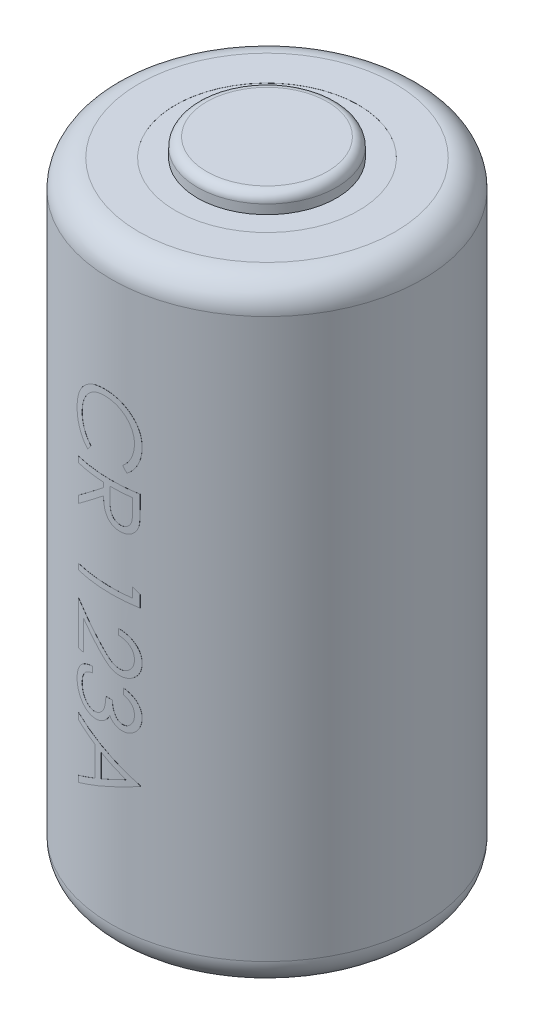
from build123d import *

# Parameters (mm, degrees)
SKIZZE1_R                            = 8.5
AUFSATZ_LINEAR_AUSTRAGEN1_DEPTH      = 33.5
SKIZZE2_R                            = 3.799988553
AUFSATZ_LINEAR_AUSTRAGEN2_DEPTH      = 1
VERRUNDUNG1_R                        = 1.5
VERRUNDUNG2_R                        = 0.5
SCHNITT_LINEAR_START                 = -0.005
SKIZZE3_R                            = 5
SKIZZE3_R_2                          = 3.799988553
SCHNITT_LINEAR_AUSTRAGEN1_DEPTH      = 0.005
AUFSATZ_LINEAR_AUSTRAGEN3_REACH      = 38.534
AUFSATZ_LINEAR_AUSTRAGEN3_END_RADIUS = 8.505


with BuildPart() as part:
    # Skizze1 → Aufsatz-Linear austragen1 (new body)
    with BuildSketch(Plane(origin=(0, 0, 0), x_dir=(1, 0, 0), z_dir=(0, 1, 0))):
        with Locations(Location((0, 0, 0), (0, 0, 270))):
            Circle(SKIZZE1_R)
    extrude(amount=AUFSATZ_LINEAR_AUSTRAGEN1_DEPTH)

    # Skizze2 → Aufsatz-Linear austragen2 (add)
    with BuildSketch(Plane(origin=(0, 33.5, 0), x_dir=(1, 0, 0), z_dir=(0, 1, 0))):
        with Locations(Location((0, 0, 0), (0, 0, 270))):
            Circle(SKIZZE2_R)
    extrude(amount=AUFSATZ_LINEAR_AUSTRAGEN2_DEPTH)

    # Verrundung1
    verrundung1_edges = [part.edges().sort_by_distance(p)[0] for p in [
        (0, 0, -8.5),
        (0, 33.5, -8.5),
    ]]
    fillet(verrundung1_edges, radius=VERRUNDUNG1_R)

    # Verrundung2
    verrundung2_edges = [part.edges().sort_by_distance(p)[0] for p in [
        (0, 34.5, -3.799988553),
    ]]
    fillet(verrundung2_edges, radius=VERRUNDUNG2_R)

    # Skizze3 → Schnitt-Linear austragen1 (cut)
    with BuildSketch(Plane(origin=(0, 33.5, 0), x_dir=(1, 0, 0), z_dir=(0, 1, 0)).offset(SCHNITT_LINEAR_START)):
        with Locations(Location((0, 0, 0), (0, 0, 270))):
            Circle(SKIZZE3_R)
        with Locations(Location((0, 0, 0), (0, 0, 270))):
            Circle(SKIZZE3_R_2, mode=Mode.SUBTRACT)
    extrude(amount=SCHNITT_LINEAR_AUSTRAGEN1_DEPTH, mode=Mode.SUBTRACT)

    # Aufsatz-Linear austragen3: up to this cylinder (the profile starts inside it)
    aufsatz_linear_austragen3_end = Plane(origin=(0, 15.6548225, 0), z_dir=(0, -1, 0)) * Cylinder(AUFSATZ_LINEAR_AUSTRAGEN3_END_RADIUS, 110.548259, mode=Mode.PRIVATE)
    # Skizze4 → Aufsatz-Linear austragen3 (add, up to the surface)
    with BuildSketch(Plane.XY, mode=Mode.PRIVATE) as aufsatz_linear_austragen3_sk1:
        with BuildLine():
            Line((0.812137548, 23.222042681), (0.60180101, 23.496882424))
            add(Edge.make_bspline(
                [(0.60180101, 23.496882424), (0.62516698, 23.516488313), (0.671583895, 23.555435759), (0.73676344, 23.618094962), (0.797828701, 23.683396605), (0.855070581, 23.751315726), (0.906487347, 23.823074845), (0.95475845, 23.896935644), (0.998026188, 23.974133689), (1.050489174, 24.080885424), (1.105235329, 24.220533272), (1.15113856, 24.396328111), (1.180359736, 24.57983921), (1.183524577, 24.705036809), (1.185134343, 24.76871736)],
                knots=[0, 0, 0, 0, 0.757959112, 1.505699292, 2.245454638, 2.979532153, 3.711538275, 4.438200793, 5.171680507, 5.909471876, 7.393775596, 8.890124382, 10.418191784, 12, 12, 12, 12], degree=3))
            add(Edge.make_bspline(
                [(1.185134343, 24.76871736), (1.184728558, 24.803800233), (1.183920753, 24.873640377), (1.173338528, 24.977295144), (1.158293792, 25.079210677), (1.136513413, 25.179007988), (1.108157335, 25.276488925), (1.074903224, 25.372395725), (1.033521858, 25.465598861), (0.987821664, 25.55722001), (0.936188844, 25.644995169), (0.87988858, 25.728063146), (0.819473451, 25.806044444), (0.755099407, 25.87915515), (0.685966407, 25.946593449), (0.612887721, 26.009440138), (0.534983754, 26.066562574), (0.453715531, 26.119364439), (0.368963602, 26.166348655), (0.281261128, 26.206921801), (0.190943428, 26.24169636), (0.097825479, 26.269467711), (0.002273724, 26.291372711), (-0.09591462, 26.30650568), (-0.196548965, 26.316992708), (-0.264758187, 26.317793081), (-0.299140497, 26.318196527)],
                knots=[0, 0, 0, 0, 1.055000685, 2.100209969, 3.131349012, 4.153242145, 5.170189196, 6.184191144, 7.204341339, 8.235672124, 9.263040994, 10.265373269, 11.252624173, 12.22887325, 13.193405896, 14.155809299, 15.126090485, 16.097288279, 17.069732292, 18.038585918, 19.002221264, 19.978698174, 20.959418239, 21.948869816, 22.966084182, 24, 24, 24, 24], degree=3))
            add(Edge.make_bspline(
                [(-0.299140497, 26.318196527), (-0.350871816, 26.316934708), (-0.452439401, 26.314457293), (-0.601210012, 26.292408959), (-0.743730686, 26.258903868), (-0.879110528, 26.208688291), (-1.009018886, 26.146769241), (-1.131257739, 26.068528629), (-1.247674304, 25.977912092), (-1.355517252, 25.873637672), (-1.454030977, 25.759231856), (-1.540781558, 25.636483945), (-1.613096441, 25.505699657), (-1.673272387, 25.368323027), (-1.719529115, 25.223296913), (-1.752093239, 25.07088211), (-1.773335419, 24.911410115), (-1.775369107, 24.802440715), (-1.776404118, 24.746982584)],
                knots=[0, 0, 0, 0, 1.029171465, 2.020641659, 2.987623507, 3.938342917, 4.889210282, 5.84687017, 6.821220943, 7.821438502, 8.827599549, 9.822697543, 10.807740252, 11.797342354, 12.80366471, 13.83203677, 14.896651826, 16, 16, 16, 16], degree=3))
            add(Edge.make_bspline(
                [(-1.776404118, 24.746982584), (-1.774715339, 24.685879895), (-1.771391416, 24.565615187), (-1.743232167, 24.38924716), (-1.697574249, 24.220411395), (-1.633676327, 24.059098808), (-1.550611039, 23.905764162), (-1.449913161, 23.760167502), (-1.330624829, 23.622185931), (-1.2395417, 23.539214649), (-1.193070785, 23.496882424)],
                knots=[0, 0, 0, 0, 1.028121516, 2.023589091, 2.998037872, 3.967518031, 4.937445131, 5.927275754, 6.942489185, 8, 8, 8, 8], degree=3))
            Line((-1.193070785, 23.496882424), (-1.401303958, 23.222042681))
            add(Edge.make_bspline(
                [(-1.401303958, 23.222042681), (-1.429842459, 23.244160761), (-1.486782762, 23.288290978), (-1.567053749, 23.35974943), (-1.642560487, 23.435025101), (-1.712678052, 23.514686863), (-1.778870221, 23.597781962), (-1.838917955, 23.685774076), (-1.894650403, 23.77714341), (-1.945006838, 23.87242193), (-1.990156908, 23.971296824), (-2.028273845, 24.073665195), (-2.061580939, 24.178659772), (-2.088801157, 24.286333431), (-2.110080876, 24.397045881), (-2.12429818, 24.510417263), (-2.134040734, 24.626686893), (-2.134928563, 24.705128347), (-2.135378477, 24.744879219)],
                knots=[0, 0, 0, 0, 0.986756325, 1.968786143, 2.935506311, 3.899499537, 4.868307269, 5.8376204, 6.809456583, 7.792545619, 8.781780509, 9.778496008, 10.776623214, 11.79151764, 12.812666265, 13.856269958, 14.913646641, 16, 16, 16, 16], degree=3))
            add(Edge.make_bspline(
                [(-2.135378477, 24.744879219), (-2.135116485, 24.782522886), (-2.134598427, 24.856958576), (-2.12620626, 24.966857328), (-2.114756523, 25.073846909), (-2.097516392, 25.177621535), (-2.077172051, 25.27874751), (-2.049900795, 25.376308094), (-2.019351628, 25.471263304), (-1.983446642, 25.563231645), (-1.942930459, 25.652291345), (-1.8971389, 25.738155156), (-1.846457035, 25.820783589), (-1.792002025, 25.90098901), (-1.732024723, 25.977586593), (-1.667358089, 26.051240119), (-1.598220078, 26.122362595), (-1.548365225, 26.16636528), (-1.52329915, 26.188488995)],
                knots=[0, 0, 0, 0, 1.114604814, 2.203992996, 3.262667896, 4.300477797, 5.318619304, 6.316056647, 7.298880507, 8.271930387, 9.238335007, 10.195173496, 11.151986948, 12.108099108, 13.064862484, 14.031167946, 15.010108607, 16, 16, 16, 16], degree=3))
            add(Edge.make_bspline(
                [(-1.52329915, 26.188488995), (-1.479757961, 26.223924638), (-1.393201251, 26.294368115), (-1.25291527, 26.384493799), (-1.106447061, 26.461641354), (-0.953027132, 26.524017275), (-0.792999745, 26.572780008), (-0.62628423, 26.606561203), (-0.453036288, 26.628512807), (-0.3351995, 26.631023096), (-0.275302356, 26.632299091)],
                knots=[0, 0, 0, 0, 0.994628077, 1.977248131, 2.950237994, 3.925870899, 4.908910175, 5.911660606, 6.938484602, 8, 8, 8, 8], degree=3))
            add(Edge.make_bspline(
                [(-0.275302356, 26.632299091), (-0.212349536, 26.630736941), (-0.088493793, 26.62766351), (0.093317753, 26.601766994), (0.267255421, 26.559602465), (0.43398848, 26.501541626), (0.592562947, 26.424943857), (0.74364855, 26.332216062), (0.887121922, 26.222452515), (1.021148744, 26.097031743), (1.143684832, 25.95945716), (1.251491889, 25.812140241), (1.34120918, 25.655357794), (1.416205403, 25.490840076), (1.47384985, 25.317354359), (1.514203041, 25.135270999), (1.539320156, 24.944932082), (1.542495364, 24.815069657), (1.544108702, 24.74908595)],
                knots=[0, 0, 0, 0, 1.032901378, 2.032168977, 3.007206631, 3.966850309, 4.924221947, 5.891988639, 6.871730993, 7.884084801, 8.900290346, 9.89161143, 10.874607481, 11.860025555, 12.854717796, 13.869097222, 14.917278314, 16, 16, 16, 16], degree=3))
            add(Edge.make_bspline(
                [(1.544108702, 24.74908595), (1.543626924, 24.708871399), (1.542673293, 24.629270746), (1.533361929, 24.511519236), (1.517867523, 24.39687271), (1.49663914, 24.285053911), (1.470620258, 24.175657363), (1.436559531, 24.06980539), (1.397006677, 23.966921591), (1.352614272, 23.86692891), (1.301863581, 23.770915237), (1.246743012, 23.678898047), (1.185980195, 23.591987357), (1.121583953, 23.508548372), (1.051145443, 23.430459568), (0.97695855, 23.355490747), (0.896821888, 23.286231616), (0.840417335, 23.24347816), (0.812137548, 23.222042681)],
                knots=[0, 0, 0, 0, 1.096705196, 2.170817488, 3.219277236, 4.250701065, 5.274195539, 6.284202015, 7.28098643, 8.279664616, 9.266225751, 10.241373748, 11.203306326, 12.157093976, 13.114198862, 14.069774147, 15.032234603, 16, 16, 16, 16], degree=3))
        make_face()
    aufsatz_linear_austragen3_tool1 = extrude(aufsatz_linear_austragen3_sk1.sketch, amount=AUFSATZ_LINEAR_AUSTRAGEN3_REACH, mode=Mode.PRIVATE) & aufsatz_linear_austragen3_end
    add(aufsatz_linear_austragen3_tool1.solids().sort_by_distance((0.746809, 23.389952, 0))[0])
    # Skizze4 → Aufsatz-Linear austragen3 (add, up to the surface)
    with BuildSketch(Plane.XY, mode=Mode.PRIVATE) as aufsatz_linear_austragen3_sk2:
        with BuildLine():
            Line((1.454365112, 22.504093963), (1.454365112, 21.80367329))
            add(Edge.make_bspline(
                [(1.454365112, 21.80367329), (1.454209526, 21.756932161), (1.453910784, 21.667184017), (1.452245021, 21.538610746), (1.447470666, 21.421783649), (1.443362082, 21.31676381), (1.435870141, 21.223553155), (1.428709494, 21.141865864), (1.419335833, 21.072078167), (1.41063041, 21.029832315), (1.40668883, 21.01070454)],
                knots=[0, 0, 0, 0, 1.410062039, 2.707475311, 3.878576406, 4.937260626, 5.877586885, 6.699081471, 7.410979367, 8, 8, 8, 8], degree=3))
            add(Edge.make_bspline(
                [(1.40668883, 21.01070454), (1.400362783, 20.985097464), (1.387845639, 20.934429582), (1.361375626, 20.86148606), (1.330794417, 20.791947595), (1.294596859, 20.726075144), (1.253414315, 20.663862597), (1.207006171, 20.605403103), (1.155136087, 20.551030892), (1.099128607, 20.500327595), (1.038495049, 20.454366688), (0.97411868, 20.414593537), (0.906402136, 20.380535988), (0.835109603, 20.353346822), (0.760843742, 20.331473971), (0.682956073, 20.316046319), (0.601794786, 20.306795522), (0.54643692, 20.305853612), (0.518367516, 20.305376014)],
                knots=[0, 0, 0, 0, 1.02737288, 2.032829108, 3.019628684, 3.985738875, 4.958353778, 5.924249254, 6.890702889, 7.883913451, 8.865824512, 9.85161466, 10.829249435, 11.81541824, 12.821369441, 13.843154991, 14.906364023, 16, 16, 16, 16], degree=3))
            add(Edge.make_bspline(
                [(0.518367516, 20.305376014), (0.471732358, 20.306844974), (0.380735085, 20.309711295), (0.248674954, 20.336436932), (0.125482898, 20.380211504), (0.011330359, 20.440541967), (-0.091617661, 20.517334891), (-0.181734433, 20.609622523), (-0.257842153, 20.716933557), (-0.310058757, 20.817302112), (-0.343657158, 20.906004496), (-0.36741579, 20.979244166), (-0.385462767, 21.05919693), (-0.401864947, 21.144715744), (-0.414381128, 21.236461164), (-0.423269996, 21.334248438), (-0.428985605, 21.438322137), (-0.42982068, 21.509661899), (-0.430250272, 21.546361591)],
                knots=[0, 0, 0, 0, 1.260402266, 2.459371274, 3.627181936, 4.786749125, 5.93865593, 7.087644312, 8.261344208, 9.485713728, 10.136162886, 10.825977872, 11.566646758, 12.35154167, 13.181268117, 14.0701832, 15.007234106, 16, 16, 16, 16], degree=3))
            Line((-0.430250272, 21.546361591), (-2.045634888, 20.260504219))
            Line((-2.045634888, 20.260504219), (-2.045634888, 20.648925693))
            Line((-2.045634888, 20.648925693), (-0.430250272, 21.934783065))
            Line((-0.430250272, 21.934783065), (-0.430250272, 22.189991399))
            Line((-0.430250272, 22.189991399), (-2.045634888, 22.189991399))
            Line((-2.045634888, 22.189991399), (-2.045634888, 22.504093963))
            Line((-2.045634888, 22.504093963), (1.454365112, 22.504093963))
        make_face()
        with BuildLine():
            Line((1.095390753, 22.189991399), (-0.071275913, 22.189991399))
            Line((-0.071275913, 22.189991399), (-0.076183766, 21.549166078))
            add(Edge.make_bspline(
                [(-0.076183766, 21.549166078), (-0.076197002, 21.519246039), (-0.076222659, 21.461252482), (-0.072228884, 21.377351816), (-0.067685561, 21.29923171), (-0.06073623, 21.227190939), (-0.05178011, 21.161197426), (-0.040577283, 21.101283808), (-0.027524707, 21.047353424), (-0.007325244, 20.984452072), (0.024695395, 20.914234557), (0.071203548, 20.837828514), (0.130079173, 20.77298334), (0.196332539, 20.717074233), (0.270674926, 20.67400998), (0.349806555, 20.64266676), (0.433044259, 20.622997142), (0.490216103, 20.620658703), (0.519068638, 20.619478578)],
                knots=[0, 0, 0, 0, 1.14660753, 2.222451964, 3.218720504, 4.145691244, 4.995719623, 5.770487122, 6.480909919, 7.121111896, 8.299844659, 9.430703709, 10.534634535, 11.641396424, 12.741395289, 13.810956493, 14.895269934, 16, 16, 16, 16], degree=3))
            add(Edge.make_bspline(
                [(0.519068638, 20.619478578), (0.547223017, 20.62066233), (0.603014723, 20.623008096), (0.68446816, 20.64270487), (0.761895021, 20.674512282), (0.8338195, 20.719113634), (0.899651492, 20.773007527), (0.955200409, 20.837014539), (1.00171939, 20.907911198), (1.031229533, 20.97422142), (1.049358083, 21.033449576), (1.062099247, 21.084881682), (1.072422096, 21.143216452), (1.080447915, 21.208314084), (1.087670236, 21.280056805), (1.092352997, 21.358641061), (1.095183259, 21.443976103), (1.095319979, 21.503123286), (1.095390753, 21.533741399)],
                knots=[0, 0, 0, 0, 1.100801541, 2.181386982, 3.260112282, 4.364594493, 5.481957178, 6.577424609, 7.668452592, 8.790448866, 9.403819393, 10.091598921, 10.863153553, 11.720938239, 12.658472417, 13.685008818, 14.801622349, 16, 16, 16, 16], degree=3))
            Line((1.095390753, 21.533741399), (1.095390753, 22.189991399))
        make_face(mode=Mode.SUBTRACT)
    aufsatz_linear_austragen3_tool2 = extrude(aufsatz_linear_austragen3_sk2.sketch, amount=AUFSATZ_LINEAR_AUSTRAGEN3_REACH, mode=Mode.PRIVATE) & aufsatz_linear_austragen3_end
    add(aufsatz_linear_austragen3_tool2.solids().sort_by_distance((-0.10468, 21.567098, 0))[0])
    # Skizze4 → Aufsatz-Linear austragen3 (add, up to the surface)
    with BuildSketch(Plane.XY, mode=Mode.PRIVATE) as aufsatz_linear_austragen3_sk3:
        Polygon((1.454365112, 17.766613995), (1.454365112, 17.119478578), (-2.045634888, 17.119478578), (-2.045634888, 17.433581142), (1.095390753, 17.433581142), (1.095390753, 17.972042681), align=None)
    aufsatz_linear_austragen3_tool3 = extrude(aufsatz_linear_austragen3_sk3.sketch, amount=AUFSATZ_LINEAR_AUSTRAGEN3_REACH, mode=Mode.PRIVATE) & aufsatz_linear_austragen3_end
    add(aufsatz_linear_austragen3_tool3.solids().sort_by_distance((-0.101766, 17.323734, 0))[0])
    # Skizze4 → Aufsatz-Linear austragen3 (add, up to the surface)
    with BuildSketch(Plane.XY, mode=Mode.PRIVATE) as aufsatz_linear_austragen3_sk4:
        with BuildLine():
            Line((0.377442036, 15.369478578), (0.377442036, 15.683581142))
            add(Edge.make_bspline(
                [(0.377442036, 15.683581142), (0.419113129, 15.681534338), (0.500954047, 15.677514468), (0.620275047, 15.658681248), (0.734340365, 15.631758216), (0.842172101, 15.593601998), (0.945058395, 15.546482403), (1.041633037, 15.488794384), (1.132854518, 15.421767754), (1.216995714, 15.345525477), (1.293911286, 15.26279558), (1.361034701, 15.174073744), (1.417098552, 15.080271861), (1.464221512, 14.982203528), (1.499550068, 14.878734557), (1.52577479, 14.770853994), (1.541550295, 14.658074232), (1.543246197, 14.581234296), (1.544108702, 14.54215486)],
                knots=[0, 0, 0, 0, 1.100776268, 2.161895295, 3.184016182, 4.190939212, 5.176500551, 6.166955529, 7.155448256, 8.160289653, 9.16017456, 10.133824356, 11.091467644, 12.04088621, 13.000931625, 13.972173743, 14.968683325, 16, 16, 16, 16], degree=3))
            add(Edge.make_bspline(
                [(1.544108702, 14.54215486), (1.543210246, 14.503776786), (1.541444811, 14.428365241), (1.526283782, 14.318303227), (1.50253819, 14.213525932), (1.469222774, 14.114238166), (1.424438346, 14.021232101), (1.370640808, 13.933809057), (1.308420976, 13.850928246), (1.235167163, 13.776321462), (1.156964778, 13.707813383), (1.073476875, 13.648711128), (0.987247589, 13.598097965), (0.897619387, 13.555910285), (0.803748359, 13.524854146), (0.707001156, 13.501275938), (0.606376345, 13.487948524), (0.53826979, 13.4859031), (0.503643959, 13.484863193)],
                knots=[0, 0, 0, 0, 1.111607364, 2.184268762, 3.212621178, 4.221274766, 5.211760367, 6.196651075, 7.1921475, 8.207485113, 9.220403448, 10.201281604, 11.166441695, 12.114753415, 13.065576456, 14.026450734, 14.996634279, 16, 16, 16, 16], degree=3))
            add(Edge.make_bspline(
                [(0.503643959, 13.484863193), (0.454896124, 13.486556456), (0.35825591, 13.489913268), (0.216241048, 13.518627644), (0.078647629, 13.563474155), (-0.032089674, 13.617471512), (-0.121323167, 13.671943956), (-0.194791872, 13.721031464), (-0.273897341, 13.778496275), (-0.358374678, 13.845174773), (-0.448885583, 13.919687645), (-0.545375379, 14.002709808), (-0.646847148, 14.09483329), (-0.71615275, 14.159491791), (-0.752065176, 14.192996206)],
                knots=[0, 0, 0, 0, 1.184426356, 2.348067706, 3.509069118, 4.696110526, 5.333549288, 6.050745305, 6.844228056, 7.710549037, 8.667450064, 9.695053472, 10.805634456, 12, 12, 12, 12], degree=3))
            Line((-0.752065176, 14.192996206), (-1.686660529, 15.068697328))
            Line((-1.686660529, 15.068697328), (-1.686660529, 13.439991399))
            Line((-1.686660529, 13.439991399), (-2.045634888, 13.439991399))
            Line((-2.045634888, 13.439991399), (-2.045634888, 15.818196527))
            Line((-2.045634888, 15.818196527), (-0.597117259, 14.460824732))
            add(Edge.make_bspline(
                [(-0.597117259, 14.460824732), (-0.562620834, 14.427774505), (-0.496360262, 14.364291784), (-0.399592547, 14.27453999), (-0.309925211, 14.193798781), (-0.226960917, 14.122014596), (-0.151169996, 14.059128372), (-0.081958491, 14.005341317), (-0.019920356, 13.960415702), (0.052959451, 13.912803911), (0.142046982, 13.86740291), (0.250368976, 13.827500075), (0.362124569, 13.803343441), (0.43762282, 13.800430827), (0.475599087, 13.798965758)],
                knots=[0, 0, 0, 0, 1.329530082, 2.553755191, 3.672934919, 4.687409497, 5.60679272, 6.413407421, 7.126401618, 7.737995624, 8.834647426, 9.90044882, 10.943907757, 12, 12, 12, 12], degree=3))
            add(Edge.make_bspline(
                [(0.475599087, 13.798965758), (0.499483124, 13.79959497), (0.546553976, 13.800835025), (0.61552187, 13.811986421), (0.6823074, 13.828370035), (0.746084812, 13.853622246), (0.808108484, 13.883961846), (0.866492703, 13.922722924), (0.923227646, 13.967016657), (0.97636792, 14.018395214), (1.025052662, 14.074799323), (1.068175824, 14.134395508), (1.104215176, 14.197445108), (1.133758608, 14.263685365), (1.156934007, 14.332930798), (1.172992582, 14.405315553), (1.183075067, 14.480639566), (1.184439238, 14.532073062), (1.185134343, 14.558280661)],
                knots=[0, 0, 0, 0, 0.991504627, 1.954065223, 2.895985987, 3.842598665, 4.797835564, 5.759220273, 6.74786863, 7.784730864, 8.824135544, 9.839918996, 10.835834653, 11.835434876, 12.84861661, 13.863796685, 14.911511676, 16, 16, 16, 16], degree=3))
            add(Edge.make_bspline(
                [(1.185134343, 14.558280661), (1.184419527, 14.585651616), (1.183015747, 14.63940365), (1.173190015, 14.71832096), (1.156255342, 14.793613011), (1.133038264, 14.865432216), (1.103807778, 14.933847773), (1.066697477, 14.998241068), (1.023156282, 15.059199991), (0.973521696, 15.116612581), (0.917999529, 15.169365744), (0.856868762, 15.216689618), (0.789731746, 15.257051879), (0.718104905, 15.292831207), (0.640083769, 15.320207689), (0.55755897, 15.343608841), (0.469358029, 15.360608049), (0.408589577, 15.366472625), (0.377442036, 15.369478578)],
                knots=[0, 0, 0, 0, 1.031212865, 2.025131798, 2.990757446, 3.934781266, 4.865570067, 5.788494791, 6.729227313, 7.684356718, 8.643577152, 9.610526866, 10.590658432, 11.59095419, 12.621640561, 13.700587263, 14.82141059, 16, 16, 16, 16], degree=3))
        make_face()
    aufsatz_linear_austragen3_tool4 = extrude(aufsatz_linear_austragen3_sk4.sketch, amount=AUFSATZ_LINEAR_AUSTRAGEN3_REACH, mode=Mode.PRIVATE) & aufsatz_linear_austragen3_end
    add(aufsatz_linear_austragen3_tool4.solids().sort_by_distance((0.420503, 15.52653, 0))[0])
    # Skizze4 → Aufsatz-Linear austragen3 (add, up to the surface)
    with BuildSketch(Plane.XY, mode=Mode.PRIVATE) as aufsatz_linear_austragen3_sk5:
        with BuildLine():
            Line((0.646672805, 12.677170886), (0.646672805, 12.99127345))
            add(Edge.make_bspline(
                [(0.646672805, 12.99127345), (0.681905289, 12.982763899), (0.750781913, 12.966128424), (0.849189174, 12.93143085), (0.942312695, 12.893631595), (1.028408769, 12.84824249), (1.109207672, 12.798733736), (1.182876796, 12.742011015), (1.251289762, 12.680691292), (1.312002999, 12.612866343), (1.366980728, 12.541737681), (1.413855786, 12.466303061), (1.454179939, 12.388080168), (1.487400171, 12.306527035), (1.512425694, 12.221400863), (1.5305825, 12.13347124), (1.542373614, 12.04250774), (1.543524377, 11.980760149), (1.544108702, 11.949406463)],
                knots=[0, 0, 0, 0, 1.162005537, 2.271625781, 3.343758855, 4.383309926, 5.390229558, 6.379919256, 7.361854164, 8.333198761, 9.295911338, 10.242430842, 11.177959212, 12.116337295, 13.062827104, 14.020064771, 14.994644689, 16, 16, 16, 16], degree=3))
            add(Edge.make_bspline(
                [(1.544108702, 11.949406463), (1.542729472, 11.903723721), (1.540001096, 11.81335471), (1.51508666, 11.680591663), (1.475661528, 11.552564844), (1.4211878, 11.430675596), (1.354000487, 11.317457163), (1.27403575, 11.216720976), (1.182836449, 11.129832466), (1.082103885, 11.056938088), (0.974448375, 10.999863089), (0.863648218, 10.957776715), (0.749966247, 10.932155034), (0.673208968, 10.928834478), (0.634753734, 10.927170886)],
                knots=[0, 0, 0, 0, 1.083050992, 2.142477498, 3.193116406, 4.255571735, 5.30263384, 6.308962982, 7.297363603, 8.282367274, 9.249857812, 10.179914175, 11.08814088, 12, 12, 12, 12], degree=3))
            add(Edge.make_bspline(
                [(0.634753734, 10.927170886), (0.59774694, 10.928334477), (0.525330385, 10.930611444), (0.419608888, 10.949945149), (0.319967288, 10.982481412), (0.225986126, 11.027551175), (0.138261286, 11.085892725), (0.056595395, 11.156565422), (-0.019373763, 11.240068084), (-0.062893236, 11.303347022), (-0.085298349, 11.335924892)],
                knots=[0, 0, 0, 0, 1.024540389, 2.004866551, 2.965041327, 3.920577974, 4.882998113, 5.874504559, 6.905732034, 8, 8, 8, 8], degree=3))
            add(Edge.make_bspline(
                [(-0.085298349, 11.335924892), (-0.103276521, 11.298693138), (-0.138896478, 11.224926263), (-0.208752236, 11.124375734), (-0.289408583, 11.033097858), (-0.352351236, 10.982194139), (-0.383976234, 10.956618001)],
                knots=[0, 0, 0, 0, 1.015518401, 2.012035669, 3.001164323, 4, 4, 4, 4], degree=3))
            add(Edge.make_bspline(
                [(-0.383976234, 10.956618001), (-0.407031528, 10.939769803), (-0.45276457, 10.906349309), (-0.526336896, 10.865213928), (-0.600481127, 10.827469445), (-0.67811252, 10.799690597), (-0.756737418, 10.775718552), (-0.838039493, 10.759945745), (-0.921246307, 10.749820234), (-0.977563012, 10.748398405), (-1.005871266, 10.747683706)],
                knots=[0, 0, 0, 0, 1.02516404, 2.033540309, 3.025129118, 4.011046665, 4.991655828, 5.976607087, 6.982917762, 8, 8, 8, 8], degree=3))
            add(Edge.make_bspline(
                [(-1.005871266, 10.747683706), (-1.054879038, 10.749482171), (-1.152663951, 10.753070638), (-1.297167906, 10.78501544), (-1.438178645, 10.834824184), (-1.573606849, 10.904320052), (-1.700053427, 10.990304698), (-1.812675456, 11.093167704), (-1.910134371, 11.210408488), (-1.991301019, 11.341259731), (-2.056230835, 11.482964416), (-2.101285041, 11.634543394), (-2.130631923, 11.793792526), (-2.13377867, 11.90299995), (-2.135378477, 11.958521046)],
                knots=[0, 0, 0, 0, 0.95570045, 1.906903359, 2.87519758, 3.868912786, 4.869932978, 5.851730567, 6.836639976, 7.83677598, 8.849487602, 9.869908895, 10.917060885, 12, 12, 12, 12], degree=3))
            add(Edge.make_bspline(
                [(-2.135378477, 11.958521046), (-2.134510264, 11.995940346), (-2.13280191, 12.069569051), (-2.121123309, 12.17781255), (-2.099793303, 12.281134249), (-2.071089998, 12.379673847), (-2.034698256, 12.473518883), (-1.989379558, 12.562382989), (-1.936068056, 12.646812882), (-1.874134468, 12.726011833), (-1.804853128, 12.799970401), (-1.726994118, 12.866723125), (-1.641996714, 12.927382918), (-1.548873658, 12.980325557), (-1.448828401, 13.027962509), (-1.340579903, 13.067143466), (-1.225095881, 13.101629035), (-1.14461814, 13.117662499), (-1.103327195, 13.125888834)],
                knots=[0, 0, 0, 0, 1.048658725, 2.063410685, 3.046034179, 4.001477787, 4.936774919, 5.862367409, 6.792675028, 7.730719943, 8.675894397, 9.627829632, 10.600096036, 11.597688215, 12.626045268, 13.701542398, 14.82072376, 16, 16, 16, 16], degree=3))
            Line((-1.103327195, 13.125888834), (-1.103327195, 12.81178627))
            add(Edge.make_bspline(
                [(-1.103327195, 12.81178627), (-1.130276209, 12.803602979), (-1.18269438, 12.787685766), (-1.258134686, 12.760591468), (-1.327292739, 12.729723196), (-1.390675861, 12.696608638), (-1.448908263, 12.661830191), (-1.500450133, 12.622915266), (-1.547565335, 12.582746121), (-1.574109947, 12.552466768), (-1.587101234, 12.537647649)],
                knots=[0, 0, 0, 0, 1.198163088, 2.33053128, 3.407730985, 4.417276592, 5.372219308, 6.28897303, 7.162600585, 8, 8, 8, 8], degree=3))
            add(Edge.make_bspline(
                [(-1.587101234, 12.537647649), (-1.602209568, 12.518051072), (-1.632379599, 12.478918409), (-1.670881228, 12.415150178), (-1.704242253, 12.348085292), (-1.729725949, 12.276270618), (-1.75130361, 12.201255847), (-1.765424129, 12.121828482), (-1.7751123, 12.038689265), (-1.775967232, 11.981921501), (-1.776404118, 11.952912072)],
                knots=[0, 0, 0, 0, 0.946170439, 1.889420265, 2.845303464, 3.807233317, 4.801018734, 5.828864929, 6.890507805, 8, 8, 8, 8], degree=3))
            add(Edge.make_bspline(
                [(-1.776404118, 11.952912072), (-1.775789215, 11.920158126), (-1.774586824, 11.856110612), (-1.763497123, 11.762661947), (-1.747416711, 11.673732367), (-1.72226382, 11.590229398), (-1.692088772, 11.51101677), (-1.652584097, 11.437862737), (-1.607969952, 11.368616662), (-1.556075121, 11.305307134), (-1.499982427, 11.248230498), (-1.440473076, 11.198909979), (-1.379392248, 11.156192769), (-1.315315048, 11.12185526), (-1.248870024, 11.09469268), (-1.179808471, 11.07621269), (-1.10871193, 11.06336032), (-1.060382863, 11.062313824), (-1.036019503, 11.06178627)],
                knots=[0, 0, 0, 0, 1.216990249, 2.379719373, 3.493992396, 4.571561497, 5.616923107, 6.638958652, 7.655775068, 8.674704564, 9.676001865, 10.625896028, 11.54399481, 12.441854662, 13.322657739, 14.20572845, 15.095482574, 16, 16, 16, 16], degree=3))
            add(Edge.make_bspline(
                [(-1.036019503, 11.06178627), (-1.003408127, 11.063316545), (-0.938347645, 11.066369479), (-0.842630623, 11.089678465), (-0.750405058, 11.128015742), (-0.663257703, 11.181694473), (-0.582449544, 11.247006418), (-0.5106309, 11.323319362), (-0.450774202, 11.410820499), (-0.409571095, 11.491873175), (-0.382110957, 11.56384018), (-0.362856423, 11.625305719), (-0.347464689, 11.694179135), (-0.332576248, 11.769633617), (-0.320094723, 11.851987395), (-0.309640957, 11.941314664), (-0.301289441, 12.03765136), (-0.297557841, 12.104342392), (-0.295634888, 12.138709347)],
                knots=[0, 0, 0, 0, 1.070481957, 2.135637345, 3.216366529, 4.339485895, 5.485746587, 6.620975969, 7.768829582, 8.956804399, 9.598399438, 10.297751078, 11.070570279, 11.915248466, 12.824061284, 13.805856426, 14.869322739, 16, 16, 16, 16], degree=3))
            Line((-0.295634888, 12.138709347), (0.063339471, 12.138709347))
            add(Edge.make_bspline(
                [(0.063339471, 12.138709347), (0.064077479, 12.095409378), (0.065523055, 12.010595376), (0.082885965, 11.886684224), (0.107174391, 11.768053941), (0.143518792, 11.657412399), (0.187142446, 11.55689539), (0.236331302, 11.469210041), (0.292060068, 11.39643446), (0.353597359, 11.338386824), (0.420367534, 11.29578192), (0.489231031, 11.26380272), (0.561790075, 11.245055217), (0.611280059, 11.242538478), (0.636155978, 11.24127345)],
                knots=[0, 0, 0, 0, 1.321708579, 2.588902423, 3.815526512, 5.016621128, 6.138757764, 7.158873101, 8.079948563, 8.928590313, 9.728601868, 10.489025425, 11.240515403, 12, 12, 12, 12], degree=3))
            add(Edge.make_bspline(
                [(0.636155978, 11.24127345), (0.654433767, 11.241687813), (0.690796561, 11.242512168), (0.743920985, 11.252910153), (0.795424338, 11.268531552), (0.845072928, 11.290021404), (0.892578572, 11.318732768), (0.937999549, 11.35319597), (0.982097069, 11.393427642), (1.022761452, 11.44047924), (1.061118378, 11.491417612), (1.094276514, 11.546722058), (1.122381328, 11.605172769), (1.145601896, 11.666823496), (1.163058137, 11.731921209), (1.175594832, 11.800147155), (1.183432249, 11.871635009), (1.184560698, 11.920406717), (1.185134343, 11.945199732)],
                knots=[0, 0, 0, 0, 0.884317272, 1.759307272, 2.611736065, 3.488921043, 4.37244062, 5.294096728, 6.247679003, 7.258495569, 8.302441962, 9.333537773, 10.376747089, 11.440883505, 12.520330301, 13.637364711, 14.798958396, 16, 16, 16, 16], degree=3))
            add(Edge.make_bspline(
                [(1.185134343, 11.945199732), (1.18374568, 11.985052717), (1.181033298, 12.062894865), (1.157192682, 12.175091434), (1.119419683, 12.279285662), (1.0738089, 12.358660645), (1.028940108, 12.41737339), (0.990339486, 12.460133361), (0.946574287, 12.501358353), (0.89644408, 12.539430661), (0.841672641, 12.576631657), (0.781958309, 12.612606127), (0.716449737, 12.646198572), (0.67038222, 12.666646842), (0.646672805, 12.677170886)],
                knots=[0, 0, 0, 0, 1.4727372, 2.876598283, 4.222346151, 5.558423782, 6.24313385, 6.953189256, 7.68715613, 8.463578749, 9.278833271, 10.135787152, 11.040551781, 12, 12, 12, 12], degree=3))
        make_face()
    aufsatz_linear_austragen3_tool5 = extrude(aufsatz_linear_austragen3_sk5.sketch, amount=AUFSATZ_LINEAR_AUSTRAGEN3_REACH, mode=Mode.PRIVATE) & aufsatz_linear_austragen3_end
    add(aufsatz_linear_austragen3_tool5.solids().sort_by_distance((-0.324624, 11.74078, 0))[0])
    # Skizze4 → Aufsatz-Linear austragen3 (add, up to the surface)
    with BuildSketch(Plane.XY, mode=Mode.PRIVATE) as aufsatz_linear_austragen3_sk6:
        Polygon((1.454365112, 8.683581142), (-2.045634888, 7.068196527), (-2.045634888, 7.409642841), (-0.923840016, 7.927070725), (-0.923840016, 9.513709347), (-2.045634888, 10.04586079), (-2.045634888, 10.388709347), (1.454365112, 8.728452937), align=None)
        Polygon((0.772173606, 8.709522649), (-0.564865657, 9.343336751), (-0.564865657, 8.092535469), align=None, mode=Mode.SUBTRACT)
    aufsatz_linear_austragen3_tool6 = extrude(aufsatz_linear_austragen3_sk6.sketch, amount=AUFSATZ_LINEAR_AUSTRAGEN3_REACH, mode=Mode.PRIVATE) & aufsatz_linear_austragen3_end
    add(aufsatz_linear_austragen3_tool6.solids().sort_by_distance((-0.315852, 7.919693, 0))[0])


solid = part.part
